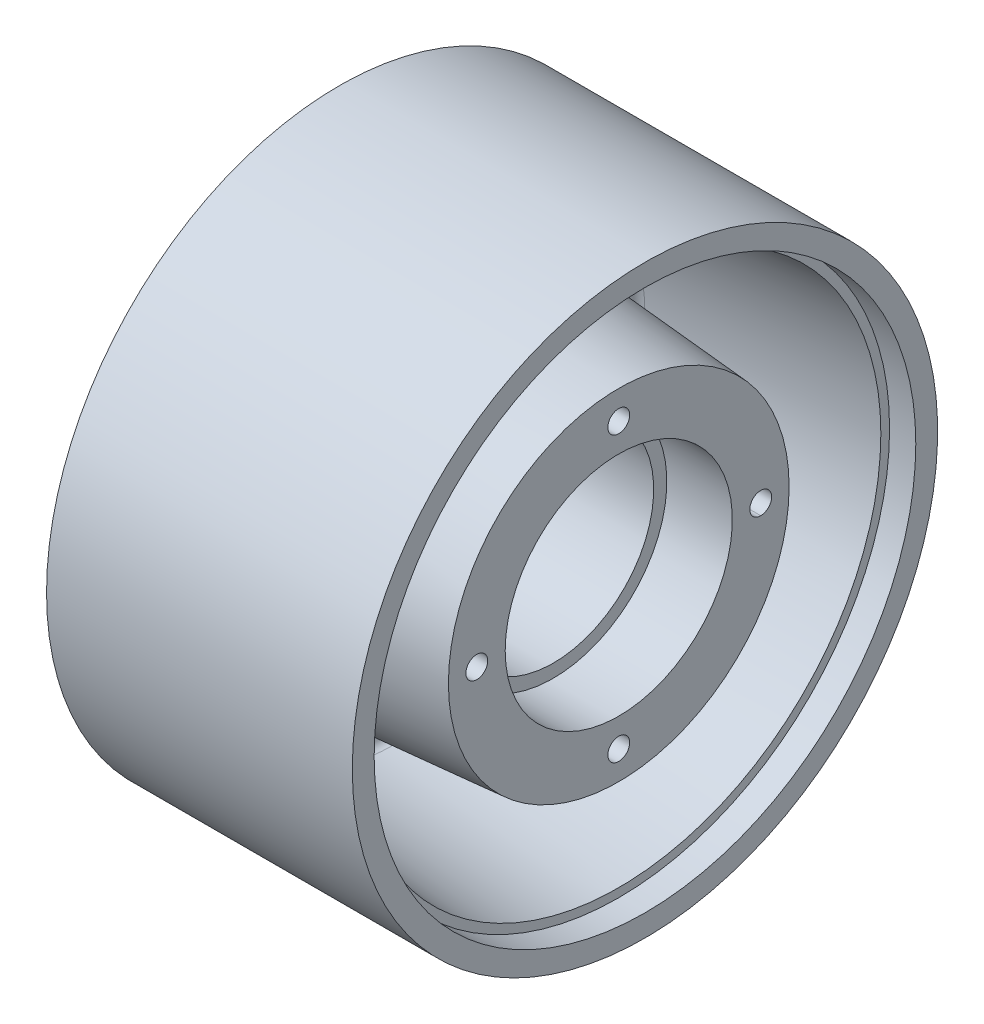
from build123d import *

# Parameters (mm, degrees)
REDONDEO1_R                = 2
TALADRO_ROSCADO_M64_D      = 5
TALADRO_ROSCADO_M64_DEPTH  = 18
TALADRO_ROSCADO_M64_TIP    = 1.502151548
TALADRO_ROSCADO_M69_D      = 5
TALADRO_ROSCADO_M69_DEPTH  = 18
TALADRO_ROSCADO_M69_TIP    = 1.502151548
TALADRO_ROSCADO_M611_D     = 5
TALADRO_ROSCADO_M611_DEPTH = 15
TALADRO_ROSCADO_M611_TIP   = 1.502151548
TALADRO_ROSCADO_M612_D     = 5
TALADRO_ROSCADO_M612_DEPTH = 15
TALADRO_ROSCADO_M612_TIP   = 1.502151548
TALADRO_ROSCADO_M613_D     = 5
TALADRO_ROSCADO_M613_DEPTH = 18
TALADRO_ROSCADO_M613_TIP   = 1.502151548
TALADRO_ROSCADO_M614_D     = 5
TALADRO_ROSCADO_M614_DEPTH = 18
TALADRO_ROSCADO_M614_TIP   = 1.502151548
TALADRO_ROSCADO_M615_D     = 5
TALADRO_ROSCADO_M615_DEPTH = 15
TALADRO_ROSCADO_M615_TIP   = 1.502151548


with BuildPart() as part:
    # Croquis1 → Revolución1 (revolve)
    with BuildSketch(Plane.XY, mode=Mode.PRIVATE) as revoluci_n1_sk:
        Polygon((0, 67), (70, 67), (70, 62), (64, 62), (64, 60), (12, 56), (12, 43), (64, 39), (64, 26), (49, 26), (49, 23), (25, 23), (25, 26), (10, 26), (10, 40), (0, 40), align=None)
    revolve(revoluci_n1_sk.sketch.rotate(Axis((-33.5154853, 0, 0), (1, 0, 0)), 90), axis=Axis((-33.5154853, 0, 0), (1, 0, 0)))

    # Redondeo1
    redondeo1_edges = [part.edges().sort_by_distance(p)[0] for p in [
        (12, 0, -43),
        (12, 0, -56),
    ]]
    fillet(redondeo1_edges, radius=REDONDEO1_R)

    # Taladro roscado M64
    with Locations(Plane(origin=(64, 0, 0), x_dir=(0, 0, -1), z_dir=(1, 0, 0))):
        with Locations((0, 32.5)):
            Hole(TALADRO_ROSCADO_M64_D / 2, depth=TALADRO_ROSCADO_M64_DEPTH)
            with Locations((0, 0, -(TALADRO_ROSCADO_M64_DEPTH + TALADRO_ROSCADO_M64_TIP / 2))):  # 118° drill point
                Cone(0, TALADRO_ROSCADO_M64_D / 2, TALADRO_ROSCADO_M64_TIP, mode=Mode.SUBTRACT)

    # Taladro roscado M69
    with Locations(Plane(origin=(64, 0, 0), x_dir=(0, 0, -1), z_dir=(1, 0, 0))):
        with Locations((0, -32.470562189)):
            Hole(TALADRO_ROSCADO_M69_D / 2, depth=TALADRO_ROSCADO_M69_DEPTH)
            with Locations((0, 0, -(TALADRO_ROSCADO_M69_DEPTH + TALADRO_ROSCADO_M69_TIP / 2))):  # 118° drill point
                Cone(0, TALADRO_ROSCADO_M69_D / 2, TALADRO_ROSCADO_M69_TIP, mode=Mode.SUBTRACT)

    # Taladro roscado M611
    with Locations(Plane.ZY.offset(-10)):
        with Locations((0, 32.498213501)):
            Hole(TALADRO_ROSCADO_M611_D / 2, depth=TALADRO_ROSCADO_M611_DEPTH)
            with Locations((0, 0, -(TALADRO_ROSCADO_M611_DEPTH + TALADRO_ROSCADO_M611_TIP / 2))):  # 118° drill point
                Cone(0, TALADRO_ROSCADO_M611_D / 2, TALADRO_ROSCADO_M611_TIP, mode=Mode.SUBTRACT)

    # Taladro roscado M612
    with Locations(Plane.ZY.offset(-10)):
        with Locations((0, -32.50019141)):
            Hole(TALADRO_ROSCADO_M612_D / 2, depth=TALADRO_ROSCADO_M612_DEPTH)
            with Locations((0, 0, -(TALADRO_ROSCADO_M612_DEPTH + TALADRO_ROSCADO_M612_TIP / 2))):  # 118° drill point
                Cone(0, TALADRO_ROSCADO_M612_D / 2, TALADRO_ROSCADO_M612_TIP, mode=Mode.SUBTRACT)

    # Taladro roscado M613
    with Locations(Plane(origin=(64, 0, 0), x_dir=(0, 0, -1), z_dir=(1, 0, 0))):
        with Locations((32.501693853, 0)):
            Hole(TALADRO_ROSCADO_M613_D / 2, depth=TALADRO_ROSCADO_M613_DEPTH)
            with Locations((0, 0, -(TALADRO_ROSCADO_M613_DEPTH + TALADRO_ROSCADO_M613_TIP / 2))):  # 118° drill point
                Cone(0, TALADRO_ROSCADO_M613_D / 2, TALADRO_ROSCADO_M613_TIP, mode=Mode.SUBTRACT)

    # Taladro roscado M614
    with Locations(Plane(origin=(64, 0, 0), x_dir=(0, 0, -1), z_dir=(1, 0, 0))):
        with Locations((32.5, 0), (-32.5, 0)):
            Hole(TALADRO_ROSCADO_M614_D / 2, depth=TALADRO_ROSCADO_M614_DEPTH)
            with Locations((0, 0, -(TALADRO_ROSCADO_M614_DEPTH + TALADRO_ROSCADO_M614_TIP / 2))):  # 118° drill point
                Cone(0, TALADRO_ROSCADO_M614_D / 2, TALADRO_ROSCADO_M614_TIP, mode=Mode.SUBTRACT)

    # Taladro roscado M615
    with Locations(Plane.ZY.offset(-10)):
        with Locations((-32.497793678, 0), (32.497518122, 0)):
            Hole(TALADRO_ROSCADO_M615_D / 2, depth=TALADRO_ROSCADO_M615_DEPTH)
            with Locations((0, 0, -(TALADRO_ROSCADO_M615_DEPTH + TALADRO_ROSCADO_M615_TIP / 2))):  # 118° drill point
                Cone(0, TALADRO_ROSCADO_M615_D / 2, TALADRO_ROSCADO_M615_TIP, mode=Mode.SUBTRACT)


solid = part.part
